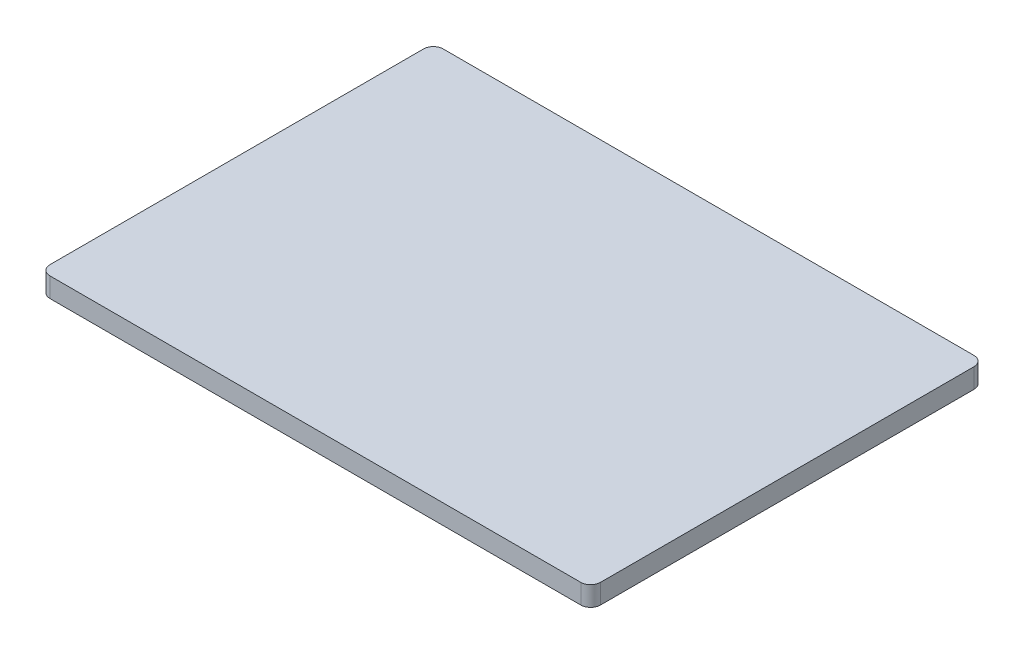
from build123d import *

# Parameters (mm, degrees)
SKETCH1_W           = 280
SKETCH1_H           = 200
BOSS_EXTRUDE1_DEPTH = 5
FILLET1_R           = 5


with BuildPart() as part:
    # Sketch1 → Boss-Extrude1 (new, symmetric)
    with BuildSketch(Plane(origin=(0, 0, 0), x_dir=(1, 0, 0), z_dir=(0, 1, 0))):
        Rectangle(SKETCH1_W, SKETCH1_H)
    extrude(amount=BOSS_EXTRUDE1_DEPTH, both=True)

    # Fillet1
    fillet1_edges = [part.edges().sort_by_distance(p)[0] for p in [
        (140, 0, 100),
        (-140, 0, 100),
        (-140, 0, -100),
        (140, 0, -100),
    ]]
    fillet(fillet1_edges, radius=FILLET1_R)


solid = part.part
